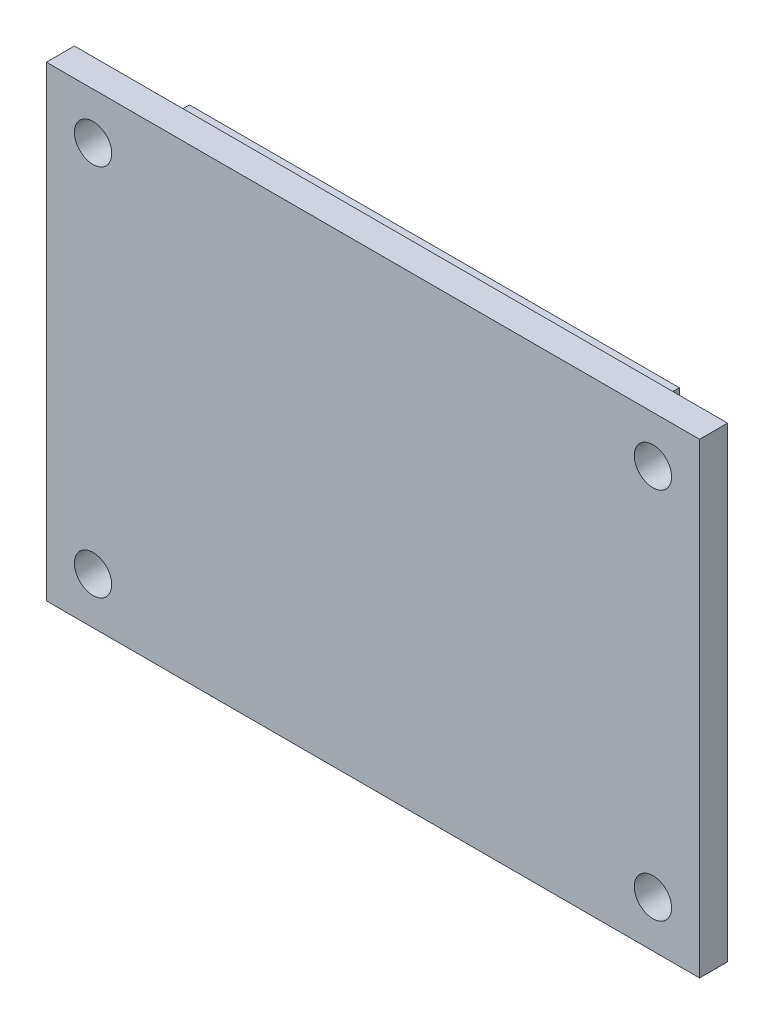
from build123d import *

# Parameters (mm, degrees)
SKETCH1_W           = 70
SKETCH1_H           = 50
SKETCH1_R           = 2
BOSS_EXTRUDE1_DEPTH = 3
SKETCH2_W           = 52.5
SKETCH2_H           = 15.87
BOSS_EXTRUDE2_DEPTH = 4.83


with BuildPart() as part:
    # Sketch1 → Boss-Extrude1 (new body)
    with BuildSketch(Plane.XY.offset(-23)):
        with Locations((-14.828582329, -15.804770786)):
            Rectangle(SKETCH1_W, SKETCH1_H)
        with Locations((15.171417671, -35.804770786)):
            Circle(SKETCH1_R, mode=Mode.SUBTRACT)
        with Locations((-44.828582329, -35.804770786)):
            Circle(SKETCH1_R, mode=Mode.SUBTRACT)
        with Locations((-44.828582329, 4.195229214)):
            Circle(SKETCH1_R, mode=Mode.SUBTRACT)
        with Locations((15.171417671, 4.195229214)):
            Circle(SKETCH1_R, mode=Mode.SUBTRACT)
    extrude(amount=-BOSS_EXTRUDE1_DEPTH)

    # Sketch2 → Boss-Extrude2 (add)
    with BuildSketch(Plane(origin=(0, 0, -26), x_dir=(-1, 0, 0), z_dir=(0, 0, -1))):
        with Locations((16.078582329, -2.869770786)):
            Rectangle(SKETCH2_W, SKETCH2_H)
    extrude(amount=BOSS_EXTRUDE2_DEPTH)


solid = part.part
